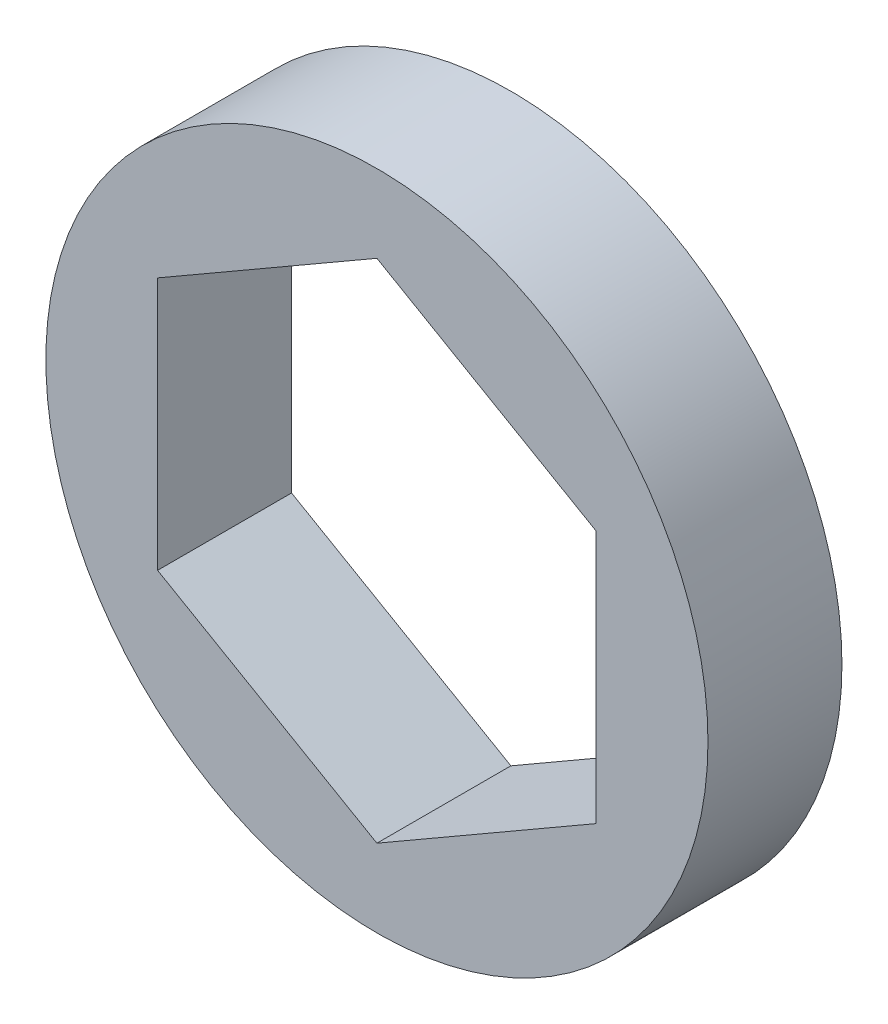
from build123d import *

# Parameters (mm, degrees)
SKETCH1_R           = 10.16
BOSS_EXTRUDE1_DEPTH = 4.111999904


with BuildPart() as part:
    # Sketch1 → Boss-Extrude1 (new body)
    with BuildSketch(Plane.XY):
        Circle(SKETCH1_R)
        Polygon((6.731, 3.886144662), (0, 7.772289324), (-6.731, 3.886144662), (-6.731, -3.886144662), (0, -7.772289324), (6.731, -3.886144662), align=None, mode=Mode.SUBTRACT)
    extrude(amount=BOSS_EXTRUDE1_DEPTH)


solid = part.part
